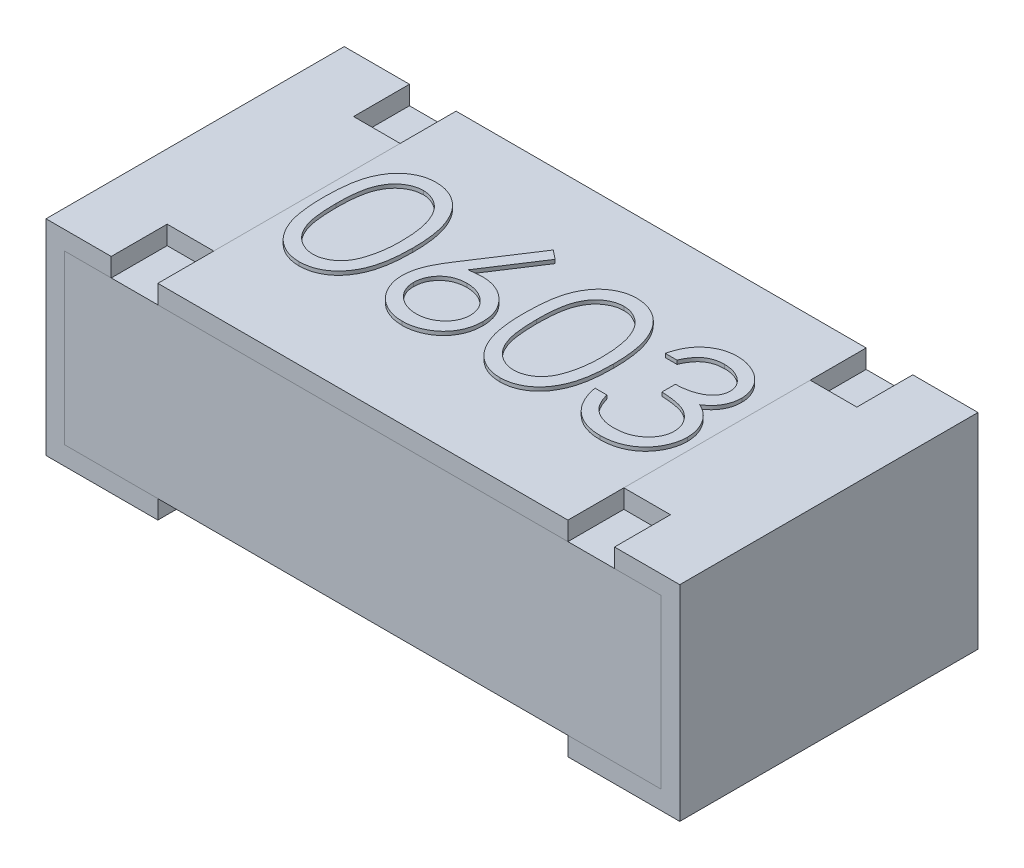
from build123d import *

# Parameters (mm, degrees)
CROQUIS1_W          = 1.6
CROQUIS1_H          = 0.8
EXTRUIR1_DEPTH      = 0.5
CROQUIS2_W          = 1.6
CROQUIS2_H          = 0.05
EXTRUIR2_DEPTH      = 2.236931688
CROQUIS4_W          = 0.8
CROQUIS4_H          = 0.05
EXTRUIR3_DEPTH      = 1.1
CROQUIS5_W          = 0.125
CROQUIS5_H          = 0.15
EXTRUIR4_DEPTH      = 0.05
BOSS_EXTRUDE1_DEPTH = 0.01


with BuildPart() as part:
    # Croquis1 → Extruir1 (new body)
    with BuildSketch(Plane(origin=(0, 0, 0), x_dir=(1, 0, 0), z_dir=(0, 1, 0))):
        Rectangle(CROQUIS1_W, CROQUIS1_H)
    extrude(amount=EXTRUIR1_DEPTH)

    # Croquis2 → Extruir2 (cut, through all)
    with BuildSketch(Plane.XY.offset(0.4)):
        with Locations((0, 0.025)):
            Rectangle(CROQUIS2_W, CROQUIS2_H)
    extrude(amount=-EXTRUIR2_DEPTH, mode=Mode.SUBTRACT)


with BuildPart() as body_2:
    # Barrer1: sweep along a path in Croquis3
    with BuildLine(Plane.XY.offset(0.4)) as barrer1_path:
        Line((-0.55, 0.55), (-0.85, 0.55))
        Line((-0.85, 0.55), (-0.85, 0))
        Line((-0.85, 0), (-0.55, 0))
    # Croquis3D1 → Barrer1 (sweep)
    with BuildSketch(Plane(origin=(-0.55, 0.55, 0.4), x_dir=(0, -0.06237828615518069, -0.9980525784828886), z_dir=(1, 0, 0))):
        Polygon((0, 0), (0.798442063, 0.049902629), (0.801560977, 0), (0.003118914, -0.049902629), align=None)
    sweep(path=barrer1_path.line, transition=Transition.RIGHT)


with BuildPart() as body_3:
    # Simetría1: mirrored copy
    add(body_2.part.mirror(Plane(origin=(0, 0.5, 0.4), x_dir=(0, 0, 1), z_dir=(1, 0, 0))))


with BuildPart() as body_4:
    # Croquis4 → Extruir3 (new body)
    with BuildSketch(Plane(origin=(-0.55, 0, 0), x_dir=(0, 0, -1), z_dir=(1, 0, 0))):
        with Locations((0, 0.525)):
            Rectangle(CROQUIS4_W, CROQUIS4_H)
    extrude(amount=EXTRUIR3_DEPTH)

    # Sketch1 → Boss-Extrude1 (add)
    # profile 1 of 4: a face of its own
    with BuildSketch(Plane(origin=(0, 0.55, 0), x_dir=(1, 0, 0), z_dir=(0, 1, 0))):
        with BuildLine():
            add(Edge.make_bspline(
                [(-0.517880419, 0.013609611), (-0.517847617, 0.019219349), (-0.517783899, 0.030116348), (-0.517075057, 0.045994812), (-0.515897523, 0.060890841), (-0.514283786, 0.074805147), (-0.512319988, 0.087741324), (-0.509698439, 0.0996648), (-0.506717159, 0.11063076), (-0.503261914, 0.120674965), (-0.499363135, 0.129932735), (-0.495119709, 0.138575256), (-0.49036323, 0.146589449), (-0.485365539, 0.154103228), (-0.479924331, 0.160993597), (-0.474194452, 0.167357864), (-0.467952265, 0.173048939), (-0.461409964, 0.178233569), (-0.454508318, 0.182778516), (-0.447444051, 0.18678179), (-0.44016854, 0.190201777), (-0.432661922, 0.19289082), (-0.424991666, 0.195111905), (-0.41713096, 0.1966308), (-0.409066823, 0.19758649), (-0.40362368, 0.197677857), (-0.400863192, 0.197724194)],
                knots=[0, 0, 0, 0, 1.646270934, 3.197905019, 4.663502075, 6.030701355, 7.308322542, 8.50163776, 9.611534131, 10.641858119, 11.616356847, 12.558055219, 13.465016945, 14.349605745, 15.204443733, 16.039544428, 16.859896111, 17.680448484, 18.487036065, 19.28249412, 20.06191084, 20.843045899, 21.620316918, 22.403196591, 23.190181807, 24, 24, 24, 24], degree=3))
            add(Edge.make_bspline(
                [(-0.400863192, 0.197724194), (-0.398079644, 0.197675412), (-0.392544043, 0.197578401), (-0.384360005, 0.196646007), (-0.376365037, 0.195098895), (-0.368593223, 0.192906797), (-0.360980725, 0.19018723), (-0.353587084, 0.186778518), (-0.346366376, 0.182810631), (-0.339433347, 0.178148243), (-0.332711886, 0.172950016), (-0.326367089, 0.167073749), (-0.320398381, 0.160578777), (-0.31473085, 0.153534591), (-0.30952529, 0.145806082), (-0.304567947, 0.137527671), (-0.300130744, 0.128554585), (-0.295857276, 0.119036538), (-0.292168577, 0.108710172), (-0.288841953, 0.097633696), (-0.286154056, 0.085676277), (-0.283915129, 0.072900653), (-0.282180639, 0.059259904), (-0.280917375, 0.044783273), (-0.280250066, 0.029461234), (-0.280124396, 0.018985449), (-0.280059906, 0.013609611)],
                knots=[0, 0, 0, 0, 0.810914788, 1.612654377, 2.396697861, 3.181598691, 3.963628158, 4.749916497, 5.551656086, 6.361998678, 7.18212741, 8.025565596, 8.878627764, 9.750805457, 10.657531673, 11.591944965, 12.560506719, 13.57287815, 14.630710178, 15.753379473, 16.941251878, 18.199788006, 19.531962791, 20.947069417, 22.433333509, 24, 24, 24, 24], degree=3))
            add(Edge.make_bspline(
                [(-0.280059906, 0.013609611), (-0.280125065, 0.00825722), (-0.280252024, -0.002171695), (-0.280909894, -0.017424793), (-0.282205757, -0.031824597), (-0.283826756, -0.045405644), (-0.286071852, -0.058111405), (-0.288832369, -0.06998585), (-0.291897401, -0.081080257), (-0.295680881, -0.091303739), (-0.299821952, -0.100798911), (-0.304327471, -0.109665626), (-0.309154454, -0.117982255), (-0.314413329, -0.12568223), (-0.32001867, -0.132820095), (-0.326090449, -0.139269858), (-0.332457507, -0.145186925), (-0.339198749, -0.150452088), (-0.346239904, -0.155060568), (-0.353435812, -0.159181953), (-0.36091415, -0.162505223), (-0.368505445, -0.165358727), (-0.376318282, -0.167538772), (-0.384342921, -0.169046157), (-0.392538545, -0.170103342), (-0.398078701, -0.17018399), (-0.400863192, -0.170224524)],
                knots=[0, 0, 0, 0, 1.561518951, 3.042555995, 4.452378317, 5.7783523, 7.031515105, 8.214008947, 9.334062868, 10.386615937, 11.391082383, 12.354592575, 13.286541444, 14.194233754, 15.072674879, 15.931287219, 16.775624067, 17.606195743, 18.42308326, 19.229000347, 20.022332153, 20.807536673, 21.593273796, 22.3848459, 23.188221202, 24, 24, 24, 24], degree=3))
            add(Edge.make_bspline(
                [(-0.400863192, -0.170224524), (-0.403623603, -0.170177889), (-0.409066596, -0.170085932), (-0.417131838, -0.169134559), (-0.424960083, -0.167605009), (-0.432589958, -0.165463348), (-0.440060609, -0.162841865), (-0.447270238, -0.159426496), (-0.454299006, -0.15549309), (-0.461128162, -0.151013547), (-0.467629378, -0.145881379), (-0.473839239, -0.14020495), (-0.479601741, -0.133842609), (-0.48496515, -0.126894817), (-0.490062559, -0.119425493), (-0.494751496, -0.111332655), (-0.499088582, -0.102648394), (-0.503052931, -0.093316603), (-0.506567797, -0.08320111), (-0.509672568, -0.072186193), (-0.512123984, -0.060174629), (-0.514222279, -0.047262892), (-0.515914718, -0.033395499), (-0.51707015, -0.018564921), (-0.517784282, -0.0027804), (-0.517847789, 0.008046577), (-0.517880419, 0.013609611)],
                knots=[0, 0, 0, 0, 0.810891512, 1.598919785, 2.382837074, 3.152667961, 3.926044502, 4.706494248, 5.493654104, 6.291793342, 7.103789334, 7.925228297, 8.761435821, 9.622817696, 10.50288917, 11.416980706, 12.369136599, 13.353924996, 14.394355917, 15.514179734, 16.714354668, 17.994756427, 19.357759367, 20.818452758, 22.365282078, 24, 24, 24, 24], degree=3))
        make_face()
        with BuildLine():
            add(Edge.make_bspline(
                [(-0.486470163, 0.013749835), (-0.486458218, 0.009074965), (-0.486435036, 1.961e-06), (-0.485829416, -0.013182366), (-0.485004393, -0.025479398), (-0.483940263, -0.036904752), (-0.482359968, -0.047419753), (-0.480589289, -0.057096722), (-0.47843448, -0.065884445), (-0.475884978, -0.073843226), (-0.472981069, -0.081108133), (-0.469810482, -0.087868255), (-0.46640441, -0.094203448), (-0.462592495, -0.100056809), (-0.458440989, -0.105447426), (-0.454043663, -0.110470709), (-0.449236404, -0.114950407), (-0.44258603, -0.120323093), (-0.433806383, -0.125875006), (-0.422744337, -0.130709615), (-0.411377492, -0.133747861), (-0.403662367, -0.134134236), (-0.399811509, -0.134327088)],
                knots=[0, 0, 0, 0, 1.459021318, 2.831673884, 4.118529203, 5.306027144, 6.411944654, 7.436330062, 8.375795394, 9.233974572, 10.042671642, 10.816086306, 11.563610507, 12.285937304, 12.993564865, 13.685989202, 14.367179055, 15.041617293, 16.353048772, 17.594441528, 18.799311195, 20, 20, 20, 20], degree=3))
            add(Edge.make_bspline(
                [(-0.399811509, -0.134327088), (-0.395935742, -0.13416731), (-0.38819221, -0.133848084), (-0.37687883, -0.13076821), (-0.365895803, -0.126121256), (-0.357288609, -0.120626506), (-0.350740355, -0.115393673), (-0.346048656, -0.110932208), (-0.341742451, -0.105936621), (-0.337658243, -0.100546692), (-0.333912336, -0.094659443), (-0.330506022, -0.088303186), (-0.327397687, -0.081460268), (-0.325626783, -0.076683294), (-0.324721365, -0.07424095)],
                knots=[0, 0, 0, 0, 1.353760809, 2.704726607, 4.075137775, 5.516104923, 6.260822281, 7.007110065, 7.778089737, 8.566572457, 9.372053459, 10.217411131, 11.088608312, 12, 12, 12, 12], degree=3))
            add(Edge.make_bspline(
                [(-0.324721365, -0.07424095), (-0.323666188, -0.071117976), (-0.321523727, -0.064777), (-0.318762549, -0.054940635), (-0.316588009, -0.044620358), (-0.314631673, -0.033877847), (-0.313296367, -0.022633877), (-0.312221586, -0.010923238), (-0.311588517, 0.001262898), (-0.311510042, 0.009542397), (-0.311470163, 0.013749835)],
                knots=[0, 0, 0, 0, 0.884706709, 1.796334032, 2.740027952, 3.714592787, 4.726048262, 5.777819803, 6.87074269, 8, 8, 8, 8], degree=3))
            add(Edge.make_bspline(
                [(-0.311470163, 0.013749835), (-0.311525182, 0.017956592), (-0.311632811, 0.026185909), (-0.312044209, 0.038237727), (-0.313106567, 0.049684503), (-0.314286479, 0.06057555), (-0.316026201, 0.07085058), (-0.317901981, 0.080595611), (-0.320422103, 0.089689913), (-0.32311408, 0.098275871), (-0.32619512, 0.106255937), (-0.329586693, 0.113667316), (-0.333208869, 0.120545788), (-0.337143093, 0.126872482), (-0.341342661, 0.132675736), (-0.345918416, 0.137839196), (-0.350688854, 0.142522893), (-0.357370572, 0.14786915), (-0.366118001, 0.153320319), (-0.377002566, 0.158336895), (-0.38832963, 0.161217724), (-0.395986976, 0.161623893), (-0.399811509, 0.161826758)],
                knots=[0, 0, 0, 0, 1.31362396, 2.569729283, 3.763502607, 4.902122613, 5.988968491, 7.01645872, 7.998833611, 8.933434873, 9.825090667, 10.667526885, 11.477055099, 12.250526234, 12.991942729, 13.710640831, 14.402115721, 15.076753259, 16.378508321, 17.609869233, 18.806226677, 20, 20, 20, 20], degree=3))
            add(Edge.make_bspline(
                [(-0.399811509, 0.161826758), (-0.403682568, 0.161623613), (-0.411431739, 0.161216954), (-0.422876534, 0.158347629), (-0.433846969, 0.153346332), (-0.442571267, 0.147851095), (-0.449257646, 0.142617264), (-0.453965915, 0.138078618), (-0.458380532, 0.133113993), (-0.462447302, 0.127673801), (-0.46625623, 0.121827264), (-0.469754332, 0.115528388), (-0.472906065, 0.108745252), (-0.475814518, 0.101483608), (-0.478371797, 0.093525514), (-0.480481193, 0.084748614), (-0.482429899, 0.075102425), (-0.483809426, 0.064530474), (-0.485035801, 0.053102259), (-0.485823936, 0.040774527), (-0.486437062, 0.027568089), (-0.486458908, 0.018448173), (-0.486470163, 0.013749835)],
                knots=[0, 0, 0, 0, 1.207732386, 2.417664972, 3.655092373, 4.956220595, 5.625982001, 6.301752483, 6.994047911, 7.697131622, 8.419323945, 9.170223765, 9.943494443, 10.752040957, 11.610060368, 12.549350801, 13.567764191, 14.679664412, 15.874934091, 17.154273443, 18.533957287, 20, 20, 20, 20], degree=3))
        make_face(mode=Mode.SUBTRACT)
    # profile 2 of 4: a face of its own
    with BuildSketch(Plane(origin=(0, 0.55, 0), x_dir=(1, 0, 0), z_dir=(0, 1, 0))):
        with BuildLine():
            Line((-0.087111189, 0.197724194), (-0.062922487, 0.178723793))
            Line((-0.062922487, 0.178723793), (-0.155400451, 0.037307527))
            add(Edge.make_bspline(
                [(-0.155400451, 0.037307527), (-0.149243424, 0.038288913), (-0.137233445, 0.040203218), (-0.125076855, 0.040519012), (-0.119152455, 0.040672912)],
                knots=[0, 0, 0, 0, 1.025318673, 2, 2, 2, 2], degree=3))
            add(Edge.make_bspline(
                [(-0.119152455, 0.040672912), (-0.115595205, 0.040577301), (-0.108592865, 0.040389093), (-0.098312185, 0.038940708), (-0.088433291, 0.036658197), (-0.07899713, 0.033330971), (-0.069969832, 0.029080736), (-0.061299592, 0.023986849), (-0.053149391, 0.017786281), (-0.045414273, 0.010859785), (-0.038391563, 0.003188087), (-0.032173958, -0.004952047), (-0.026951279, -0.013552135), (-0.022713886, -0.022607822), (-0.019423399, -0.032105148), (-0.017024634, -0.042031962), (-0.015606675, -0.052395109), (-0.015414126, -0.059442926), (-0.015316317, -0.063023002)],
                knots=[0, 0, 0, 0, 1.04369286, 2.054478336, 3.041073146, 4.015093852, 4.984733326, 5.965804835, 6.960378782, 7.985147595, 9.009457201, 10.008161701, 10.986880575, 11.956520048, 12.937015923, 13.931873656, 14.949455224, 16, 16, 16, 16], degree=3))
            add(Edge.make_bspline(
                [(-0.015316317, -0.063023002), (-0.015458627, -0.067920972), (-0.015738661, -0.077559019), (-0.01852904, -0.091596689), (-0.022865005, -0.104969941), (-0.029062758, -0.117465258), (-0.036760996, -0.129065515), (-0.046148755, -0.139344061), (-0.056893104, -0.148511065), (-0.069041784, -0.156176727), (-0.08211608, -0.162437032), (-0.09585128, -0.166933556), (-0.110113995, -0.169701903), (-0.119794455, -0.170048964), (-0.124691317, -0.170224524)],
                knots=[0, 0, 0, 0, 1.031375318, 2.029502543, 3.004789286, 3.987476834, 4.960371455, 5.9300674, 6.912260825, 7.929083631, 8.949397511, 9.960523116, 10.96833055, 12, 12, 12, 12], degree=3))
            add(Edge.make_bspline(
                [(-0.124691317, -0.170224524), (-0.129400987, -0.170071704), (-0.138730019, -0.169768993), (-0.152453298, -0.167072399), (-0.1656396, -0.162701689), (-0.178196538, -0.156680261), (-0.189828599, -0.149074473), (-0.200235163, -0.139918245), (-0.20936434, -0.129407298), (-0.216961802, -0.117543263), (-0.222987676, -0.104794268), (-0.227506668, -0.091500552), (-0.230146292, -0.077710554), (-0.230515148, -0.06836244), (-0.230700932, -0.063654011)],
                knots=[0, 0, 0, 0, 1.012016664, 2.004627821, 2.994792927, 3.992885782, 4.990978636, 5.973936114, 6.964471063, 7.975201453, 8.993600317, 9.990122807, 10.98767138, 12, 12, 12, 12], degree=3))
            add(Edge.make_bspline(
                [(-0.230700932, -0.063654011), (-0.230582788, -0.060049553), (-0.230341559, -0.052689938), (-0.22865722, -0.041543535), (-0.225950741, -0.030138427), (-0.222919716, -0.020463007), (-0.219717155, -0.012536855), (-0.217051901, -0.006146506), (-0.213734501, 0.000429601), (-0.210197163, 0.007416965), (-0.206121476, 0.014635508), (-0.201689911, 0.022205875), (-0.196779946, 0.030007668), (-0.19333793, 0.035302087), (-0.191578336, 0.038008649)],
                knots=[0, 0, 0, 0, 1.173818275, 2.396712641, 3.66331629, 4.989737886, 5.693666774, 6.447286557, 7.243889047, 8.091586357, 8.998013824, 9.943181721, 10.948533338, 12, 12, 12, 12], degree=3))
            Line((-0.191578336, 0.038008649), (-0.087111189, 0.197724194))
        make_face()
        with BuildLine():
            add(Edge.make_bspline(
                [(-0.125742999, 0.004775476), (-0.128409224, 0.004697672), (-0.133617135, 0.004545697), (-0.141257876, 0.003663172), (-0.148489201, 0.002001265), (-0.155406915, -0.000115368), (-0.161881685, -0.003025674), (-0.167960569, -0.006560854), (-0.173667074, -0.010722972), (-0.178941429, -0.015453063), (-0.183723396, -0.020631866), (-0.187841509, -0.026178818), (-0.191393749, -0.031960239), (-0.194281931, -0.038024433), (-0.196530938, -0.044369083), (-0.198157763, -0.050965008), (-0.199063139, -0.057856438), (-0.199213762, -0.062529689), (-0.199290676, -0.064916031)],
                knots=[0, 0, 0, 0, 1.129588631, 2.206414736, 3.251139165, 4.268635594, 5.265702196, 6.250456724, 7.242448911, 8.251968645, 9.246821453, 10.222880186, 11.173611482, 12.116736599, 13.062300278, 14.020270554, 14.989073742, 16, 16, 16, 16], degree=3))
            add(Edge.make_bspline(
                [(-0.199290676, -0.064916031), (-0.19922804, -0.067281028), (-0.199105219, -0.071918437), (-0.197989987, -0.078752355), (-0.196286479, -0.085328846), (-0.19375244, -0.091614006), (-0.190729751, -0.097703638), (-0.186739218, -0.103377166), (-0.18231754, -0.108979174), (-0.177032146, -0.114079321), (-0.17135981, -0.118824983), (-0.16529969, -0.122973008), (-0.158983694, -0.126521626), (-0.152326552, -0.129302736), (-0.145422713, -0.131585164), (-0.138214658, -0.133191312), (-0.130697372, -0.134099365), (-0.125605179, -0.134250184), (-0.123008624, -0.134327088)],
                knots=[0, 0, 0, 0, 0.989467248, 1.94019797, 2.891935182, 3.827694429, 4.772920941, 5.730924762, 6.725747692, 7.756678648, 8.79901574, 9.819492441, 10.826891316, 11.826466727, 12.835195252, 13.867842842, 14.912794438, 16, 16, 16, 16], degree=3))
            add(Edge.make_bspline(
                [(-0.123008624, -0.134327088), (-0.120412075, -0.134250178), (-0.115319889, -0.134099347), (-0.107802543, -0.13319138), (-0.100594711, -0.131584915), (-0.09369006, -0.129303638), (-0.087035917, -0.126518277), (-0.080725445, -0.122995085), (-0.074722636, -0.118799473), (-0.069046576, -0.114087431), (-0.063783182, -0.108950145), (-0.059255454, -0.103427173), (-0.055387131, -0.097657784), (-0.052243712, -0.091637995), (-0.049737583, -0.085325046), (-0.048025436, -0.078753374), (-0.046912507, -0.071918171), (-0.046789371, -0.067280938), (-0.046726573, -0.064916031)],
                knots=[0, 0, 0, 0, 1.087397944, 2.132534446, 3.165364764, 4.174271784, 5.174024072, 6.181601208, 7.194203697, 8.236725232, 9.267838612, 10.269026844, 11.221737037, 12.171628256, 13.107553087, 14.05945871, 15.010357665, 16, 16, 16, 16], degree=3))
            add(Edge.make_bspline(
                [(-0.046726573, -0.064916031), (-0.046781602, -0.062526575), (-0.046889607, -0.057836852), (-0.048111202, -0.05096809), (-0.049805439, -0.04433557), (-0.052363742, -0.037980975), (-0.055687397, -0.031929382), (-0.059735738, -0.026150222), (-0.064418995, -0.020599187), (-0.069828749, -0.015442906), (-0.075717772, -0.010728199), (-0.08197933, -0.006566243), (-0.088530128, -0.003053745), (-0.095363522, -0.000123035), (-0.10255781, 0.001991912), (-0.109996844, 0.003657237), (-0.117775769, 0.004543438), (-0.123053429, 0.004697145), (-0.125742999, 0.004775476)],
                knots=[0, 0, 0, 0, 0.978206639, 1.919901502, 2.851605144, 3.780102724, 4.718870031, 5.675451981, 6.667674623, 7.690630536, 8.733308323, 9.756129687, 10.767539656, 11.776269907, 12.797430371, 13.836405707, 14.897401972, 16, 16, 16, 16], degree=3))
        make_face(mode=Mode.SUBTRACT)
    # profile 3 of 4: a face of its own
    with BuildSketch(Plane(origin=(0, 0.55, 0), x_dir=(1, 0, 0), z_dir=(0, 1, 0))):
        with BuildLine():
            add(Edge.make_bspline(
                [(0.020581119, 0.013609611), (0.020613921, 0.019219349), (0.020677639, 0.030116348), (0.021386481, 0.045994812), (0.022564015, 0.060890841), (0.024177753, 0.074805147), (0.026141551, 0.087741324), (0.028763099, 0.0996648), (0.03174438, 0.11063076), (0.035199624, 0.120674965), (0.039098403, 0.129932735), (0.043341829, 0.138575256), (0.048098309, 0.146589449), (0.053096, 0.154103228), (0.058537207, 0.160993597), (0.064267086, 0.167357864), (0.070509274, 0.173048939), (0.077051574, 0.178233569), (0.083953221, 0.182778516), (0.091017488, 0.18678179), (0.098292998, 0.190201777), (0.105799616, 0.19289082), (0.113469872, 0.195111905), (0.121330579, 0.1966308), (0.129394715, 0.19758649), (0.134837859, 0.197677857), (0.137598347, 0.197724194)],
                knots=[0, 0, 0, 0, 1.646270934, 3.197905019, 4.663502075, 6.030701355, 7.308322542, 8.50163776, 9.611534131, 10.641858119, 11.616356847, 12.558055219, 13.465016945, 14.349605745, 15.204443733, 16.039544428, 16.859896111, 17.680448484, 18.487036065, 19.28249412, 20.06191084, 20.843045899, 21.620316918, 22.403196591, 23.190181807, 24, 24, 24, 24], degree=3))
            add(Edge.make_bspline(
                [(0.137598347, 0.197724194), (0.140381895, 0.197675412), (0.145917495, 0.197578401), (0.154101533, 0.196646007), (0.162096501, 0.195098895), (0.169868315, 0.192906797), (0.177480814, 0.19018723), (0.184874454, 0.186778518), (0.192095163, 0.182810631), (0.199028191, 0.178148243), (0.205749653, 0.172950016), (0.212094449, 0.167073749), (0.218063158, 0.160578777), (0.223730688, 0.153534591), (0.228936248, 0.145806082), (0.233893591, 0.137527671), (0.238330795, 0.128554585), (0.242604262, 0.119036538), (0.246292961, 0.108710172), (0.249619586, 0.097633696), (0.252307482, 0.085676277), (0.25454641, 0.072900653), (0.256280899, 0.059259904), (0.257544163, 0.044783273), (0.258211472, 0.029461234), (0.258337142, 0.018985449), (0.258401632, 0.013609611)],
                knots=[0, 0, 0, 0, 0.810914788, 1.612654377, 2.396697861, 3.181598691, 3.963628158, 4.749916497, 5.551656086, 6.361998678, 7.18212741, 8.025565596, 8.878627764, 9.750805457, 10.657531673, 11.591944965, 12.560506719, 13.57287815, 14.630710178, 15.753379473, 16.941251878, 18.199788006, 19.531962791, 20.947069417, 22.433333509, 24, 24, 24, 24], degree=3))
            add(Edge.make_bspline(
                [(0.258401632, 0.013609611), (0.258336474, 0.00825722), (0.258209515, -0.002171695), (0.257551644, -0.017424793), (0.256255781, -0.031824597), (0.254634782, -0.045405644), (0.252389686, -0.058111405), (0.249629169, -0.06998585), (0.246564137, -0.081080257), (0.242780658, -0.091303739), (0.238639587, -0.100798911), (0.234134067, -0.109665626), (0.229307084, -0.117982255), (0.22404821, -0.12568223), (0.218442869, -0.132820095), (0.21237109, -0.139269858), (0.206004031, -0.145186925), (0.19926279, -0.150452088), (0.192221635, -0.155060568), (0.185025727, -0.159181953), (0.177547388, -0.162505223), (0.169956093, -0.165358727), (0.162143257, -0.167538772), (0.154118618, -0.169046157), (0.145922994, -0.170103342), (0.140382837, -0.17018399), (0.137598347, -0.170224524)],
                knots=[0, 0, 0, 0, 1.561518951, 3.042555995, 4.452378317, 5.7783523, 7.031515105, 8.214008947, 9.334062868, 10.386615937, 11.391082383, 12.354592575, 13.286541444, 14.194233754, 15.072674879, 15.931287219, 16.775624067, 17.606195743, 18.42308326, 19.229000347, 20.022332153, 20.807536673, 21.593273796, 22.3848459, 23.188221202, 24, 24, 24, 24], degree=3))
            add(Edge.make_bspline(
                [(0.137598347, -0.170224524), (0.134837935, -0.170177889), (0.129394943, -0.170085932), (0.1213297, -0.169134559), (0.113501456, -0.167605009), (0.105871581, -0.165463348), (0.098400929, -0.162841865), (0.0911913, -0.159426496), (0.084162532, -0.15549309), (0.077333376, -0.151013547), (0.07083216, -0.145881379), (0.0646223, -0.14020495), (0.058859798, -0.133842609), (0.053496388, -0.126894817), (0.048398979, -0.119425493), (0.043710042, -0.111332655), (0.039372957, -0.102648394), (0.035408608, -0.093316603), (0.031893741, -0.08320111), (0.028788971, -0.072186193), (0.026337555, -0.060174629), (0.024239259, -0.047262892), (0.022546821, -0.033395499), (0.021391388, -0.018564921), (0.020677257, -0.0027804), (0.02061375, 0.008046577), (0.020581119, 0.013609611)],
                knots=[0, 0, 0, 0, 0.810891512, 1.598919785, 2.382837074, 3.152667961, 3.926044502, 4.706494248, 5.493654104, 6.291793342, 7.103789334, 7.925228297, 8.761435821, 9.622817696, 10.50288917, 11.416980706, 12.369136599, 13.353924996, 14.394355917, 15.514179734, 16.714354668, 17.994756427, 19.357759367, 20.818452758, 22.365282078, 24, 24, 24, 24], degree=3))
        make_face()
        with BuildLine():
            add(Edge.make_bspline(
                [(0.051991376, 0.013749835), (0.05200332, 0.009074965), (0.052026503, 1.961e-06), (0.052632123, -0.013182366), (0.053457146, -0.025479398), (0.054521276, -0.036904752), (0.05610157, -0.047419753), (0.057872249, -0.057096722), (0.060027058, -0.065884445), (0.06257656, -0.073843226), (0.06548047, -0.081108133), (0.068651056, -0.087868255), (0.072057128, -0.094203448), (0.075869043, -0.100056809), (0.08002055, -0.105447426), (0.084417876, -0.110470709), (0.089225134, -0.114950407), (0.095875508, -0.120323093), (0.104655156, -0.125875006), (0.115717201, -0.130709615), (0.127084046, -0.133747861), (0.134799171, -0.134134236), (0.138650029, -0.134327088)],
                knots=[0, 0, 0, 0, 1.459021318, 2.831673884, 4.118529203, 5.306027144, 6.411944654, 7.436330062, 8.375795394, 9.233974572, 10.042671642, 10.816086306, 11.563610507, 12.285937304, 12.993564865, 13.685989202, 14.367179055, 15.041617293, 16.353048772, 17.594441528, 18.799311195, 20, 20, 20, 20], degree=3))
            add(Edge.make_bspline(
                [(0.138650029, -0.134327088), (0.142525797, -0.13416731), (0.150269329, -0.133848084), (0.161582708, -0.13076821), (0.172565735, -0.126121256), (0.181172929, -0.120626506), (0.187721184, -0.115393673), (0.192412883, -0.110932208), (0.196719088, -0.105936621), (0.200803295, -0.100546692), (0.204549203, -0.094659443), (0.207955516, -0.088303186), (0.211063851, -0.081460268), (0.212834756, -0.076683294), (0.213740174, -0.07424095)],
                knots=[0, 0, 0, 0, 1.353760809, 2.704726607, 4.075137775, 5.516104923, 6.260822281, 7.007110065, 7.778089737, 8.566572457, 9.372053459, 10.217411131, 11.088608312, 12, 12, 12, 12], degree=3))
            add(Edge.make_bspline(
                [(0.213740174, -0.07424095), (0.21479535, -0.071117976), (0.216937812, -0.064777), (0.219698989, -0.054940635), (0.221873529, -0.044620358), (0.223829866, -0.033877847), (0.225165171, -0.022633877), (0.226239953, -0.010923238), (0.226873021, 0.001262898), (0.226951496, 0.009542397), (0.226991376, 0.013749835)],
                knots=[0, 0, 0, 0, 0.884706709, 1.796334032, 2.740027952, 3.714592787, 4.726048262, 5.777819803, 6.87074269, 8, 8, 8, 8], degree=3))
            add(Edge.make_bspline(
                [(0.226991376, 0.013749835), (0.226936357, 0.017956592), (0.226828728, 0.026185909), (0.226417329, 0.038237727), (0.225354972, 0.049684503), (0.22417506, 0.06057555), (0.222435338, 0.07085058), (0.220559557, 0.080595611), (0.218039436, 0.089689913), (0.215347458, 0.098275871), (0.212266419, 0.106255937), (0.208874845, 0.113667316), (0.205252669, 0.120545788), (0.201318445, 0.126872482), (0.197118877, 0.132675736), (0.192543122, 0.137839196), (0.187772685, 0.142522893), (0.181090966, 0.14786915), (0.172343537, 0.153320319), (0.161458973, 0.158336895), (0.150131908, 0.161217724), (0.142474563, 0.161623893), (0.138650029, 0.161826758)],
                knots=[0, 0, 0, 0, 1.31362396, 2.569729283, 3.763502607, 4.902122613, 5.988968491, 7.01645872, 7.998833611, 8.933434873, 9.825090667, 10.667526885, 11.477055099, 12.250526234, 12.991942729, 13.710640831, 14.402115721, 15.076753259, 16.378508321, 17.609869233, 18.806226677, 20, 20, 20, 20], degree=3))
            add(Edge.make_bspline(
                [(0.138650029, 0.161826758), (0.13477897, 0.161623613), (0.1270298, 0.161216954), (0.115585004, 0.158347629), (0.104614569, 0.153346332), (0.095890272, 0.147851095), (0.089203893, 0.142617264), (0.084495624, 0.138078618), (0.080081006, 0.133113993), (0.076014236, 0.127673801), (0.072205308, 0.121827264), (0.068707207, 0.115528388), (0.065555474, 0.108745252), (0.06264702, 0.101483608), (0.060089741, 0.093525514), (0.057980345, 0.084748614), (0.05603164, 0.075102425), (0.054652113, 0.064530474), (0.053425737, 0.053102259), (0.052637602, 0.040774527), (0.052024477, 0.027568089), (0.05200263, 0.018448173), (0.051991376, 0.013749835)],
                knots=[0, 0, 0, 0, 1.207732386, 2.417664972, 3.655092373, 4.956220595, 5.625982001, 6.301752483, 6.994047911, 7.697131622, 8.419323945, 9.170223765, 9.943494443, 10.752040957, 11.610060368, 12.549350801, 13.567764191, 14.679664412, 15.874934091, 17.154273443, 18.533957287, 20, 20, 20, 20], degree=3))
        make_face(mode=Mode.SUBTRACT)
    # profile 4 of 4: a face of its own
    with BuildSketch(Plane(origin=(0, 0.55, 0), x_dir=(1, 0, 0), z_dir=(0, 1, 0))):
        with BuildLine():
            Line((0.334683683, 0.107980604), (0.303273427, 0.107980604))
            add(Edge.make_bspline(
                [(0.303273427, 0.107980604), (0.304124382, 0.111503853), (0.305787929, 0.118391515), (0.309257687, 0.128232241), (0.313037612, 0.137544593), (0.317576523, 0.146154201), (0.322527398, 0.154234091), (0.32819967, 0.161601003), (0.334331643, 0.1684423), (0.341114138, 0.174513624), (0.348227004, 0.180011396), (0.355770466, 0.184698902), (0.363592755, 0.188731318), (0.371748068, 0.192053341), (0.380260686, 0.194555893), (0.389053648, 0.196371574), (0.398149998, 0.197550685), (0.404324757, 0.197665761), (0.407460126, 0.197724194)],
                knots=[0, 0, 0, 0, 1.162005537, 2.271625781, 3.343758855, 4.383309926, 5.390229558, 6.379919256, 7.361854164, 8.333198761, 9.295911338, 10.242430842, 11.177959212, 12.116337295, 13.062827104, 14.020064771, 14.994644689, 16, 16, 16, 16], degree=3))
            add(Edge.make_bspline(
                [(0.407460126, 0.197724194), (0.4120284, 0.197586271), (0.421065301, 0.197313433), (0.434341606, 0.19482199), (0.447144287, 0.190879476), (0.459333212, 0.185432104), (0.470655056, 0.178713372), (0.480728674, 0.170716899), (0.489417525, 0.161596969), (0.496706963, 0.151523712), (0.502414463, 0.140758161), (0.5066231, 0.129678145), (0.509185268, 0.118309948), (0.509517324, 0.11063422), (0.509683683, 0.106788697)],
                knots=[0, 0, 0, 0, 1.083050992, 2.142477498, 3.193116406, 4.255571735, 5.30263384, 6.308962982, 7.297363603, 8.282367274, 9.249857812, 10.179914175, 11.08814088, 12, 12, 12, 12], degree=3))
            add(Edge.make_bspline(
                [(0.509683683, 0.106788697), (0.509567324, 0.103088018), (0.509339627, 0.095846362), (0.507406257, 0.085274212), (0.504152631, 0.075310052), (0.499645654, 0.065911936), (0.493811499, 0.057139452), (0.48674423, 0.048972863), (0.478393963, 0.041375947), (0.47206607, 0.037024), (0.468808283, 0.034783489)],
                knots=[0, 0, 0, 0, 1.024540389, 2.004866551, 2.965041327, 3.920577974, 4.882998113, 5.874504559, 6.905732034, 8, 8, 8, 8], degree=3))
            add(Edge.make_bspline(
                [(0.468808283, 0.034783489), (0.472531458, 0.032985672), (0.479908146, 0.029423676), (0.489963198, 0.0224381), (0.499090986, 0.014372465), (0.504181358, 0.0080782), (0.506738972, 0.0049157)],
                knots=[0, 0, 0, 0, 1.015518401, 2.012035669, 3.001164323, 4, 4, 4, 4], degree=3))
            add(Edge.make_bspline(
                [(0.506738972, 0.0049157), (0.508423106, 0.002609925), (0.511763796, -0.001963867), (0.515887349, -0.009317509), (0.51962826, -0.016752658), (0.522543282, -0.024468599), (0.524800669, -0.0323759), (0.526414272, -0.04048814), (0.527416686, -0.048811942), (0.527560241, -0.05444319), (0.527632401, -0.057273803)],
                knots=[0, 0, 0, 0, 1.025084078, 2.033381695, 3.024893161, 4.013698104, 4.991890475, 5.976764909, 6.982997093, 8, 8, 8, 8], degree=3))
            add(Edge.make_bspline(
                [(0.527632401, -0.057273803), (0.52745295, -0.062174775), (0.527094892, -0.071953655), (0.523894484, -0.086401127), (0.51893316, -0.100523678), (0.511887467, -0.114031162), (0.503300716, -0.1266692), (0.493084983, -0.137976831), (0.481356342, -0.147696691), (0.468275778, -0.155817714), (0.454104065, -0.162309506), (0.438946505, -0.16681525), (0.4230215, -0.16974985), (0.41210077, -0.170064537), (0.406548667, -0.170224524)],
                knots=[0, 0, 0, 0, 0.955779014, 1.907060117, 2.875433937, 3.871313158, 4.872415639, 5.851225146, 6.836215519, 7.83643374, 8.849228613, 9.86973379, 10.916971861, 12, 12, 12, 12], degree=3))
            add(Edge.make_bspline(
                [(0.406548667, -0.170224524), (0.402806737, -0.170137703), (0.395443867, -0.169966867), (0.384619517, -0.168799007), (0.374287347, -0.166666007), (0.364433387, -0.163795676), (0.355048883, -0.160156502), (0.346162473, -0.155624632), (0.337719484, -0.150293482), (0.329799589, -0.144100123), (0.322403732, -0.137171989), (0.315728459, -0.129386088), (0.30966248, -0.120886348), (0.304368216, -0.111574042), (0.299604521, -0.101569516), (0.295686425, -0.090744667), (0.292237868, -0.079196264), (0.290634522, -0.07114849), (0.289811888, -0.067019396)],
                knots=[0, 0, 0, 0, 1.048658725, 2.063410685, 3.046034179, 4.001477787, 4.936774919, 5.862367409, 6.792675028, 7.730719943, 8.675894397, 9.627829632, 10.600096036, 11.597688215, 12.626045268, 13.701542398, 14.82072376, 16, 16, 16, 16], degree=3))
            Line((0.289811888, -0.067019396), (0.321222145, -0.067019396))
            add(Edge.make_bspline(
                [(0.321222145, -0.067019396), (0.322040474, -0.069714297), (0.323632195, -0.074956114), (0.326341625, -0.082500145), (0.329428452, -0.08941595), (0.332739908, -0.095754262), (0.336217753, -0.101577503), (0.340109245, -0.10673169), (0.34412616, -0.11144321), (0.347154095, -0.114097671), (0.348636007, -0.1153968)],
                knots=[0, 0, 0, 0, 1.198163088, 2.33053128, 3.407730985, 4.417276592, 5.372219308, 6.28897303, 7.162600585, 8, 8, 8, 8], degree=3))
            add(Edge.make_bspline(
                [(0.348636007, -0.1153968), (0.350595665, -0.116907633), (0.354508931, -0.119924636), (0.360885754, -0.123774799), (0.367592243, -0.127110902), (0.37477371, -0.129659271), (0.382275187, -0.131817037), (0.390217924, -0.133229089), (0.398531845, -0.134197906), (0.404208622, -0.1342834), (0.407109565, -0.134327088)],
                knots=[0, 0, 0, 0, 0.946170439, 1.889420265, 2.845303464, 3.807233317, 4.801018734, 5.828864929, 6.890507805, 8, 8, 8, 8], degree=3))
            add(Edge.make_bspline(
                [(0.407109565, -0.134327088), (0.410384915, -0.134265498), (0.41678958, -0.134145063), (0.426135066, -0.133037492), (0.43502581, -0.131424451), (0.443363103, -0.128933152), (0.451256154, -0.125855067), (0.458594319, -0.121990227), (0.465473929, -0.117455755), (0.47180687, -0.112301839), (0.477501421, -0.106659689), (0.482515372, -0.100758382), (0.486777838, -0.094622799), (0.490216196, -0.088218987), (0.492931251, -0.081573464), (0.494779571, -0.074667581), (0.496064722, -0.067557855), (0.496169384, -0.062724958), (0.496222145, -0.060288627)],
                knots=[0, 0, 0, 0, 1.217147791, 2.380027433, 3.494444702, 4.572153297, 5.609568379, 6.639424714, 7.649109417, 8.668170816, 9.669597737, 10.625200337, 11.543417969, 12.441394052, 13.322311151, 14.205496177, 15.095365482, 16, 16, 16, 16], degree=3))
            add(Edge.make_bspline(
                [(0.496222145, -0.060288627), (0.496069115, -0.057027493), (0.495763816, -0.050521452), (0.493432958, -0.040949695), (0.489599071, -0.031727353), (0.48423182, -0.023011774), (0.477698247, -0.014934184), (0.470061757, -0.007727036), (0.461258934, -0.001780027), (0.453156947, 0.002328839), (0.445980431, 0.005132546), (0.439838893, 0.007000043), (0.432963233, 0.008581408), (0.425436598, 0.010052636), (0.417202276, 0.01130477), (0.408269232, 0.012348952), (0.398635656, 0.013184456), (0.39196654, 0.013557566), (0.388529837, 0.013749835)],
                knots=[0, 0, 0, 0, 1.07054697, 2.135767047, 3.216561865, 4.33974944, 5.486079747, 6.621378074, 7.775625952, 8.963672916, 9.598146892, 10.304877434, 11.070270905, 11.915000392, 12.823868403, 13.805723172, 14.86925407, 16, 16, 16, 16], degree=3))
            Line((0.388529837, 0.013749835), (0.388529837, 0.049647271))
            add(Edge.make_bspline(
                [(0.388529837, 0.049647271), (0.392859954, 0.049720751), (0.401341588, 0.049864681), (0.413731019, 0.051605482), (0.42557835, 0.054013545), (0.436621024, 0.057702064), (0.446685896, 0.061986094), (0.455417856, 0.066971315), (0.46269457, 0.07251279), (0.468480678, 0.078696051), (0.472833601, 0.085327555), (0.47601628, 0.092239221), (0.477896313, 0.099491627), (0.47814728, 0.104441094), (0.478273427, 0.106928921)],
                knots=[0, 0, 0, 0, 1.321986639, 2.589447074, 3.816329219, 5.01088745, 6.139805852, 7.153945165, 8.075214402, 8.924034688, 9.728124013, 10.488707548, 11.240355623, 12, 12, 12, 12], degree=3))
            add(Edge.make_bspline(
                [(0.478273427, 0.106928921), (0.478231986, 0.108756696), (0.478149541, 0.112392967), (0.477109813, 0.117705474), (0.475547409, 0.122855568), (0.473399436, 0.127821349), (0.470524416, 0.132568377), (0.467083817, 0.137137121), (0.462987007, 0.141501499), (0.458292463, 0.145569531), (0.453251282, 0.149446455), (0.447726305, 0.152737819), (0.441884117, 0.155552325), (0.435718252, 0.157873275), (0.429208699, 0.159619204), (0.422386043, 0.160872788), (0.415237274, 0.161656554), (0.410360101, 0.161769395), (0.407880799, 0.161826758)],
                knots=[0, 0, 0, 0, 0.884392785, 1.759457502, 2.611959086, 3.489218968, 4.37281399, 5.2945488, 6.255912374, 7.266815255, 8.301784654, 9.332968512, 10.37626691, 11.440494194, 12.520033166, 13.637162961, 14.798855837, 16, 16, 16, 16], degree=3))
            add(Edge.make_bspline(
                [(0.407880799, 0.161826758), (0.403895632, 0.161687622), (0.396111674, 0.161415856), (0.384890183, 0.159035555), (0.374458249, 0.155237747), (0.366484382, 0.150704445), (0.360596125, 0.146229401), (0.356388431, 0.142321163), (0.35225638, 0.13797788), (0.348471812, 0.132932043), (0.344644415, 0.127525364), (0.341159959, 0.121482996), (0.337773989, 0.114962556), (0.335733734, 0.110352993), (0.334683683, 0.107980604)],
                knots=[0, 0, 0, 0, 1.472543308, 2.876219568, 4.221790263, 5.565193594, 6.249813518, 6.953379497, 7.687249741, 8.463570142, 9.283606569, 10.136032583, 11.040678096, 12, 12, 12, 12], degree=3))
        make_face()
    extrude(amount=BOSS_EXTRUDE1_DEPTH)


with BuildPart() as extruir4_tool:
    # Croquis5 → Extruir4 (new body)
    with BuildSketch(Plane(origin=(0, 0.55, 0), x_dir=(1, 0, 0), z_dir=(0, 1, 0))):
        with Locations((-0.6125, -0.325)):
            Rectangle(CROQUIS5_W, CROQUIS5_H)
        with Locations((-0.6125, 0.325)):
            Rectangle(CROQUIS5_W, CROQUIS5_H)
        with Locations((0.6125, 0.325)):
            Rectangle(CROQUIS5_W, CROQUIS5_H)
        with Locations((0.6125, -0.325)):
            Rectangle(CROQUIS5_W, CROQUIS5_H)
    extrude(amount=-EXTRUIR4_DEPTH)


with BuildPart() as body_2_1:
    add(body_2.part)

    # Extruir4: cut by extruir4_tool
    add(extruir4_tool.part, mode=Mode.SUBTRACT)


with BuildPart() as body_3_1:
    add(body_3.part)

    # Extruir4: cut by extruir4_tool
    add(extruir4_tool.part, mode=Mode.SUBTRACT)


solid = Compound([part.part, body_4.part, body_2_1.part, body_3_1.part])
